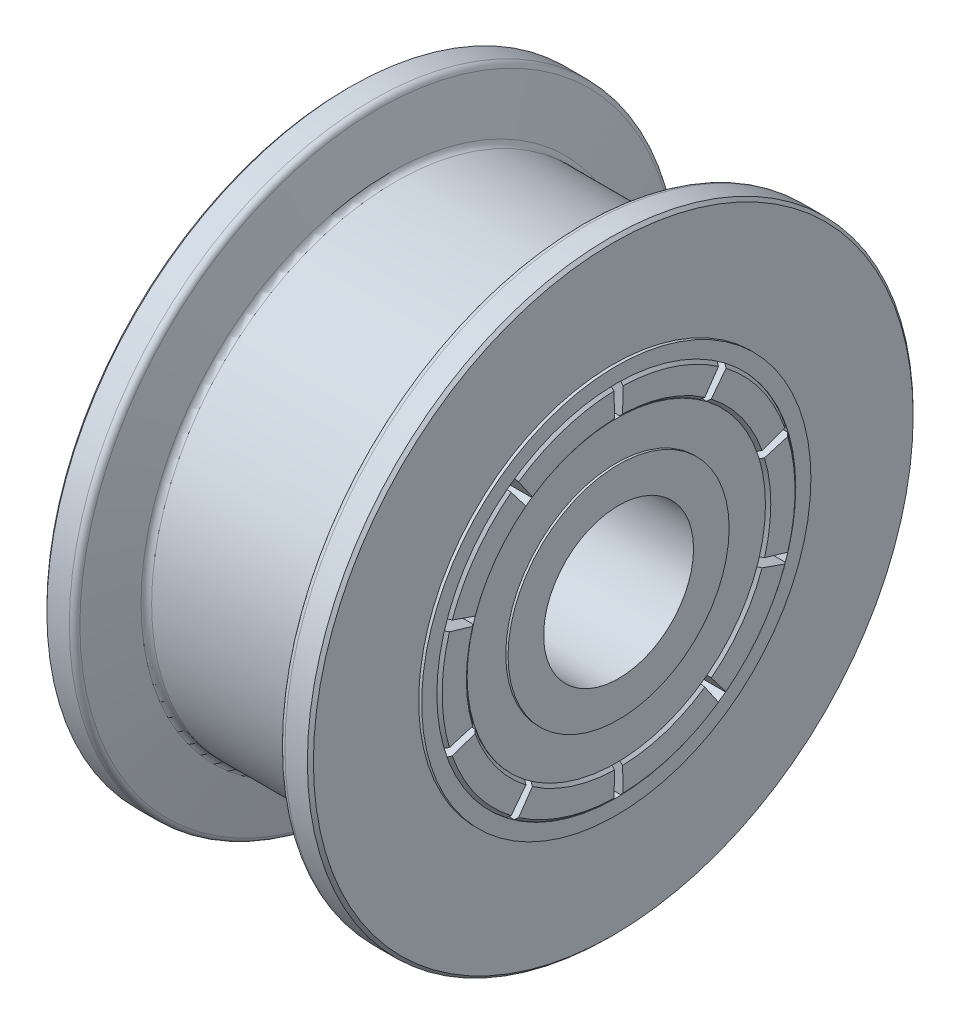
from build123d import *

# Parameters (mm, degrees)
SKETCH1_R               = 10
SKETCH1_R_2             = 6.425
BOSS_EXTRUDE1_DEPTH     = 4.4
FILLET1_R               = 0.2
CHAMFER1_SIZE           = 0.1
SKETCH3_R               = 3.65
SKETCH3_R_2             = 2.475
BOSS_EXTRUDE2_DEPTH     = 4.575
SKETCH4_R               = 4.925
SKETCH4_R_2             = 3.65
BOSS_EXTRUDE3_DEPTH     = 4.5
SKETCH5_R               = 5.925
SKETCH5_R_2             = 4.925
BOSS_EXTRUDE4_DEPTH     = 4.575
CHAMFER3_SIZE           = 0.1
CUT_EXTRUDE1_DEPTH      = 15.863737776
CUT_EXTRUDE1_DEPTH_BACK = 15.863737776
SKETCH7_R               = 6.425
SKETCH7_R_2             = 5.925
BOSS_EXTRUDE5_DEPTH     = 4.5


with BuildPart() as part:
    # Sketch1 → Boss-Extrude1 (new, symmetric)
    with BuildSketch(Plane(origin=(0, 0, 0), x_dir=(0, 0, -1), z_dir=(1, 0, 0))):
        Circle(SKETCH1_R)
        Circle(SKETCH1_R_2, mode=Mode.SUBTRACT)
    extrude(amount=BOSS_EXTRUDE1_DEPTH, both=True)

    # Sketch2 → Cut-Revolve1 (revolve, cut)
    with BuildSketch(Plane.XY, mode=Mode.PRIVATE) as cut_revolve1_sk:
        Polygon((-3.4, 10), (-2.95, 8.05), (2.95, 8.05), (3.4, 10), align=None)
    revolve(cut_revolve1_sk.sketch.rotate(Axis((-5.583711813, 0, 0), (1, 0, 0)), 90), axis=Axis((-5.583711813, 0, 0), (1, 0, 0)), mode=Mode.SUBTRACT)

    # Fillet1
    fillet1_edges = [part.edges().sort_by_distance(p)[0] for p in [
        (3.4, -10, 0),
        (2.95, 0, -8.05),
        (-2.95, 0, -8.05),
        (-3.4, 10, 0),
    ]]
    fillet(fillet1_edges, radius=FILLET1_R)

    # Chamfer1
    chamfer1_edges = [part.edges().sort_by_distance(p)[0] for p in [
        (-4.4, 0, 10),
        (4.4, 0, 10),
    ]]
    chamfer(chamfer1_edges, length=CHAMFER1_SIZE)


with BuildPart() as body_2:
    # Sketch3 → Boss-Extrude2 (new, symmetric)
    with BuildSketch(Plane(origin=(0, 0, 0), x_dir=(0, 0, -1), z_dir=(1, 0, 0))):
        Circle(SKETCH3_R)
        Circle(SKETCH3_R_2, mode=Mode.SUBTRACT)
    extrude(amount=BOSS_EXTRUDE2_DEPTH, both=True)


with BuildPart() as body_3:
    # Sketch4 → Boss-Extrude3 (new, symmetric)
    with BuildSketch(Plane(origin=(0, 0, 0), x_dir=(0, 0, -1), z_dir=(1, 0, 0))):
        Circle(SKETCH4_R)
        Circle(SKETCH4_R_2, mode=Mode.SUBTRACT)
    extrude(amount=BOSS_EXTRUDE3_DEPTH, both=True)


with BuildPart() as body_4:
    # Sketch5 → Boss-Extrude4 (new, symmetric)
    with BuildSketch(Plane(origin=(0, 0, 0), x_dir=(0, 0, -1), z_dir=(1, 0, 0))):
        Circle(SKETCH5_R)
        Circle(SKETCH5_R_2, mode=Mode.SUBTRACT)
    extrude(amount=BOSS_EXTRUDE4_DEPTH, both=True)

    # Chamfer3
    chamfer3_edges = [body_4.edges().sort_by_distance(p)[0] for p in [
        (-4.575, 0, 5.925),
        (4.575, 0, 5.925),
        (-4.575, 0, 4.925),
        (4.575, 0, 4.925),
    ]]
    chamfer(chamfer3_edges, length=CHAMFER3_SIZE)

    # Sketch6 → Cut-Extrude1 (cut, two sides: drawn at the far end of the back side and taken through both)
    with BuildSketch(Plane(origin=(0, 0, 0), x_dir=(0, 0, -1), z_dir=(1, 0, 0)).offset(-CUT_EXTRUDE1_DEPTH_BACK)):
        with BuildLine():
            Line((0.12892147, 4.923312326), (0.155098419, 5.92296965))
            ThreePointArc((0.155098419, 5.92296965), (0, 5.925), (-0.155098419, 5.92296965))
            Line((-0.155098419, 5.92296965), (-0.12892147, 4.923312326))
            ThreePointArc((-0.12892147, 4.923312326), (0, 4.925), (0.12892147, 4.923312326))
        make_face()
        with BuildLine():
            Line((2.998150038, 3.907265201), (3.606911467, 4.700618541))
            ThreePointArc((3.606911467, 4.700618541), (3.48262762, 4.793425692), (3.355956954, 4.882947668))
            Line((3.355956954, 4.882947668), (2.789550717, 4.058821479))
            ThreePointArc((2.789550717, 4.058821479), (2.894842368, 3.984408697), (2.998150038, 3.907265201))
        make_face()
        with BuildLine():
            Line((4.722187194, 1.398775573), (5.681006929, 1.682790917))
            ThreePointArc((5.681006929, 1.682790917), (5.635009859, 1.830925692), (5.585150835, 1.977805641))
            Line((5.585150835, 1.977805641), (4.642509344, 1.643998782))
            ThreePointArc((4.642509344, 1.643998782), (4.683953343, 1.521908697), (4.722187194, 1.398775573))
        make_face()
        with BuildLine():
            Line((4.642509344, -1.643998782), (5.585150835, -1.977805641))
            ThreePointArc((5.585150835, -1.977805641), (5.635009859, -1.830925692), (5.681006929, -1.682790917))
            Line((5.681006929, -1.682790917), (4.722187194, -1.398775573))
            ThreePointArc((4.722187194, -1.398775573), (4.683953343, -1.521908697), (4.642509344, -1.643998782))
        make_face()
        with BuildLine():
            Line((2.789550717, -4.058821479), (3.355956954, -4.882947668))
            ThreePointArc((3.355956954, -4.882947668), (3.48262762, -4.793425692), (3.606911467, -4.700618541))
            Line((3.606911467, -4.700618541), (2.998150038, -3.907265201))
            ThreePointArc((2.998150038, -3.907265201), (2.894842368, -3.984408697), (2.789550717, -4.058821479))
        make_face()
        with BuildLine():
            Line((-0.12892147, -4.923312326), (-0.155098419, -5.92296965))
            ThreePointArc((-0.155098419, -5.92296965), (0, -5.925), (0.155098419, -5.92296965))
            Line((0.155098419, -5.92296965), (0.12892147, -4.923312326))
            ThreePointArc((0.12892147, -4.923312326), (0, -4.925), (-0.12892147, -4.923312326))
        make_face()
        with BuildLine():
            Line((-2.998150038, -3.907265201), (-3.606911467, -4.700618541))
            ThreePointArc((-3.606911467, -4.700618541), (-3.48262762, -4.793425692), (-3.355956954, -4.882947668))
            Line((-3.355956954, -4.882947668), (-2.789550717, -4.058821479))
            ThreePointArc((-2.789550717, -4.058821479), (-2.894842368, -3.984408697), (-2.998150038, -3.907265201))
        make_face()
        with BuildLine():
            Line((-4.722187194, -1.398775573), (-5.681006929, -1.682790917))
            ThreePointArc((-5.681006929, -1.682790917), (-5.635009859, -1.830925692), (-5.585150835, -1.977805641))
            Line((-5.585150835, -1.977805641), (-4.642509344, -1.643998782))
            ThreePointArc((-4.642509344, -1.643998782), (-4.683953343, -1.521908697), (-4.722187194, -1.398775573))
        make_face()
        with BuildLine():
            Line((-4.642509344, 1.643998782), (-5.585150835, 1.977805641))
            ThreePointArc((-5.585150835, 1.977805641), (-5.635009859, 1.830925692), (-5.681006929, 1.682790917))
            Line((-5.681006929, 1.682790917), (-4.722187194, 1.398775573))
            ThreePointArc((-4.722187194, 1.398775573), (-4.683953343, 1.521908697), (-4.642509344, 1.643998782))
        make_face()
        with BuildLine():
            Line((-2.789550717, 4.058821479), (-3.355956954, 4.882947668))
            ThreePointArc((-3.355956954, 4.882947668), (-3.48262762, 4.793425692), (-3.606911467, 4.700618541))
            Line((-3.606911467, 4.700618541), (-2.998150038, 3.907265201))
            ThreePointArc((-2.998150038, 3.907265201), (-2.894842368, 3.984408697), (-2.789550717, 4.058821479))
        make_face()
    extrude(amount=CUT_EXTRUDE1_DEPTH + CUT_EXTRUDE1_DEPTH_BACK, mode=Mode.SUBTRACT)


with BuildPart() as cut_extrude1_piece_1:
    # of the separate pieces the step leaves, piece 1, a body of its own (cut_extrude1_pieces)
    add(body_4.part.solids().sort_by_distance((-4.475, -5.92296965, -0.155098419))[0])


with BuildPart() as cut_extrude1_piece_2:
    # of the separate pieces the step leaves, piece 2, a body of its own (cut_extrude1_pieces)
    add(body_4.part.solids().sort_by_distance((-4.475, -4.882947668, 3.355956954))[0])


with BuildPart() as cut_extrude1_piece_3:
    # of the separate pieces the step leaves, piece 3, a body of its own (cut_extrude1_pieces)
    add(body_4.part.solids().sort_by_distance((-4.475, -1.682790917, -5.681006929))[0])


with BuildPart() as cut_extrude1_piece_4:
    # of the separate pieces the step leaves, piece 4, a body of its own (cut_extrude1_pieces)
    add(body_4.part.solids().sort_by_distance((4.475, 4.882947668, -3.355956954))[0])


with BuildPart() as cut_extrude1_piece_5:
    # of the separate pieces the step leaves, piece 5, a body of its own (cut_extrude1_pieces)
    add(body_4.part.solids().sort_by_distance((4.475, 4.700618541, 3.606911467))[0])


with BuildPart() as cut_extrude1_piece_6:
    # of the separate pieces the step leaves, piece 6, a body of its own (cut_extrude1_pieces)
    add(body_4.part.solids().sort_by_distance((4.475, 1.682790917, 5.681006929))[0])


with BuildPart() as cut_extrude1_piece_7:
    # of the separate pieces the step leaves, piece 7, a body of its own (cut_extrude1_pieces)
    add(body_4.part.solids().sort_by_distance((4.475, 1.977805641, -5.585150835))[0])


with BuildPart() as cut_extrude1_piece_8:
    # of the separate pieces the step leaves, piece 8, a body of its own (cut_extrude1_pieces)
    add(body_4.part.solids().sort_by_distance((-4.475, -1.977805641, 5.585150835))[0])


with BuildPart() as cut_extrude1_piece_9:
    # of the separate pieces the step leaves, piece 9, a body of its own (cut_extrude1_pieces)
    add(body_4.part.solids().sort_by_distance((-4.475, -4.700618541, -3.606911467))[0])


with BuildPart() as cut_extrude1_piece_10:
    # of the separate pieces the step leaves, piece 10, a body of its own (cut_extrude1_pieces)
    add(body_4.part.solids().sort_by_distance((-4.475, 5.92296965, 0.155098419))[0])


with BuildPart() as body_14:
    # Sketch7 → Boss-Extrude5 (new, symmetric)
    with BuildSketch(Plane(origin=(0, 0, 0), x_dir=(0, 0, -1), z_dir=(1, 0, 0))):
        Circle(SKETCH7_R)
        Circle(SKETCH7_R_2, mode=Mode.SUBTRACT)
    extrude(amount=BOSS_EXTRUDE5_DEPTH, both=True)


solid = Compound([part.part, body_2.part, body_3.part, cut_extrude1_piece_1.part, cut_extrude1_piece_2.part, cut_extrude1_piece_3.part, cut_extrude1_piece_4.part, cut_extrude1_piece_5.part, cut_extrude1_piece_6.part, cut_extrude1_piece_7.part, cut_extrude1_piece_8.part, cut_extrude1_piece_9.part, cut_extrude1_piece_10.part, body_14.part])
